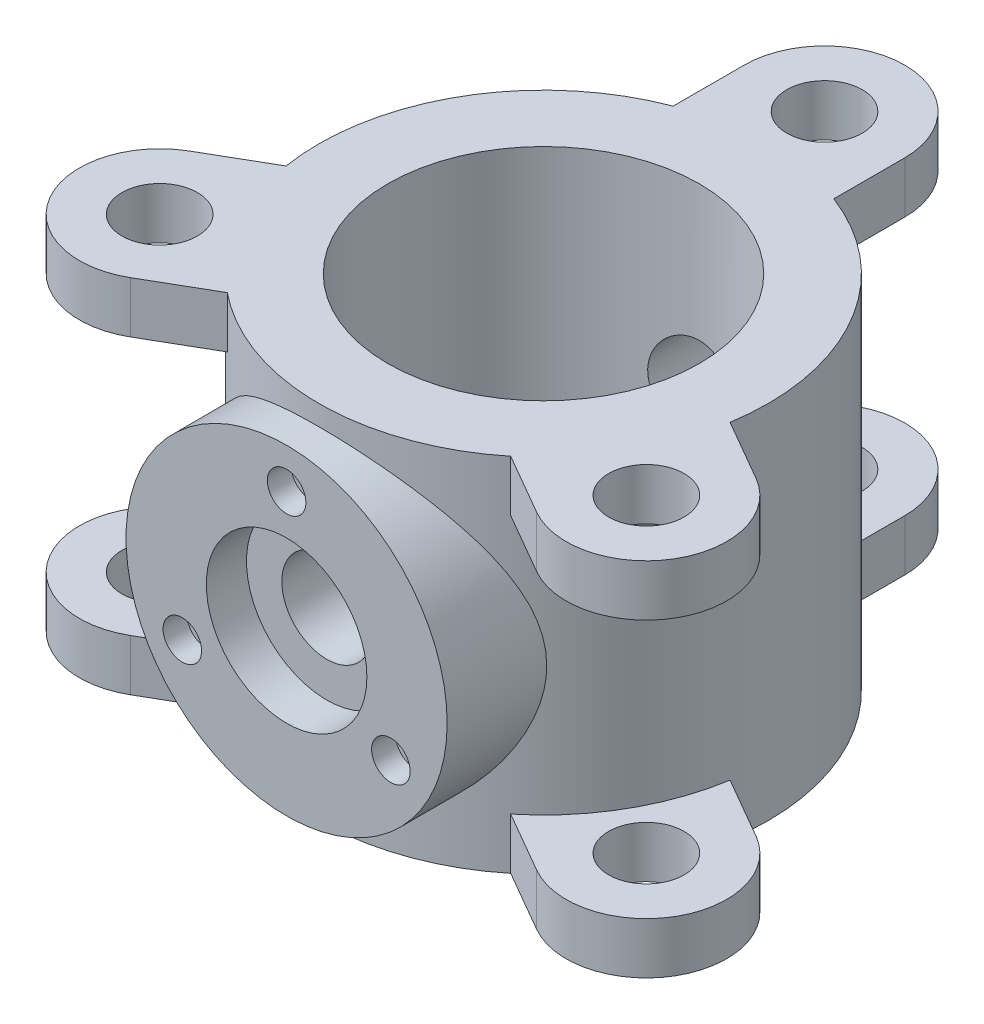
from build123d import *

# Parameters (mm, degrees)
SKETCH1_R                            = 246.38
SKETCH1_R_2                          = 59.69
BOSS_EXTRUDE1_DEPTH                  = 81.28
SKETCH2_R                            = 355.6
SKETCH2_R_2                          = 246.38
BOSS_EXTRUDE2_DEPTH                  = 204.47
BOSS_EXTRUDE3_START                  = 381
SKETCH3_R                            = 254
BOSS_EXTRUDE3_DEPTH                  = 25.4
BOSS_EXTRUDE3_DIRECTION_2_REACH      = 1339.721
BOSS_EXTRUDE3_DIRECTION_2_END_RADIUS = 355.6
SKETCH4_R                            = 30.48
CUT_EXTRUDE1_DEPTH                   = 38.1
SKETCH4_4_R                          = 127
CUT_EXTRUDE2_DEPTH                   = 63.5
SKETCH5_R                            = 71.12
CUT_EXTRUDE3_DEPTH                   = 762


with BuildPart() as part:
    # Sketch1 → Boss-Extrude1 (new body)
    with BuildSketch(Plane(origin=(0, 0, 0), x_dir=(1, 0, 0), z_dir=(0, 1, 0))):
        with BuildLine():
            Line((-127, 444.5), (-127, 332.148099498))
            ThreePointArc((-127, 332.148099498), (-307.958633586, 177.8), (-351.148691984, -56.088823468))
            Line((-351.148691984, -56.088823468), (-448.448291982, -112.264773719))
            ThreePointArc((-448.448291982, -112.264773719), (-494.933518263, -285.75), (-321.448291982, -332.235226281))
            Line((-321.448291982, -332.235226281), (-224.148691984, -276.05927603))
            ThreePointArc((-224.148691984, -276.05927603), (0, -355.6), (224.148691984, -276.05927603))
            Line((224.148691984, -276.05927603), (321.448291982, -332.235226281))
            ThreePointArc((321.448291982, -332.235226281), (494.933518263, -285.75), (448.448291982, -112.264773719))
            Line((448.448291982, -112.264773719), (351.148691984, -56.088823468))
            ThreePointArc((351.148691984, -56.088823468), (307.958633586, 177.8), (127, 332.148099498))
            Line((127, 332.148099498), (127, 444.5))
            ThreePointArc((127, 444.5), (0, 571.5), (-127, 444.5))
        make_face()
        Circle(SKETCH1_R, mode=Mode.SUBTRACT)
        with Locations((0, 444.5)):
            Circle(SKETCH1_R_2, mode=Mode.SUBTRACT)
        with Locations((384.948291982, -222.25)):
            Circle(SKETCH1_R_2, mode=Mode.SUBTRACT)
        with Locations((-384.948291982, -222.25)):
            Circle(SKETCH1_R_2, mode=Mode.SUBTRACT)
    extrude(amount=BOSS_EXTRUDE1_DEPTH)

    # Sketch2 → Boss-Extrude2 (add)
    with BuildSketch(Plane(origin=(0, 81.28, 0), x_dir=(1, 0, 0), z_dir=(0, 1, 0))):
        Circle(SKETCH2_R)
        Circle(SKETCH2_R_2, mode=Mode.SUBTRACT)
    extrude(amount=BOSS_EXTRUDE2_DEPTH)

    # Mirror2: part across plane


with BuildPart() as part_1:
    add(part.part)
    add(part.part.mirror(Plane.ZX.offset(285.75)))

    # Sketch3 → Boss-Extrude3 (add)
    with BuildSketch(Plane.XY.offset(BOSS_EXTRUDE3_START)):
        with Locations((0, 285.75)):
            Circle(SKETCH3_R)
    extrude(amount=BOSS_EXTRUDE3_DEPTH)

    # Boss-Extrude3 direction 2: up to this cylinder (the profile starts outside it)
    boss_extrude3_direction_2_end = Plane(origin=(0, 285.75, 0), z_dir=(0, -1, 0)) * Cylinder(BOSS_EXTRUDE3_DIRECTION_2_END_RADIUS, 3391.642, mode=Mode.PRIVATE)
    # Sketch3 → Boss-Extrude3 direction 2 (add, up to the surface)
    with BuildSketch(Plane.XY.offset(BOSS_EXTRUDE3_START), mode=Mode.PRIVATE) as boss_extrude3_direction_2_sk1:
        with Locations((0, 285.75)):
            Circle(SKETCH3_R)
    boss_extrude3_direction_2_tool1 = extrude(boss_extrude3_direction_2_sk1.sketch, amount=-BOSS_EXTRUDE3_DIRECTION_2_REACH, mode=Mode.PRIVATE) - boss_extrude3_direction_2_end
    add(boss_extrude3_direction_2_tool1.solids().sort_by_distance((0, 285.75, 381))[0])

    # Sketch4 → Cut-Extrude1 (cut)
    with BuildSketch(Plane.XY.offset(406.4)):
        with Locations((0, 476.25)):
            Circle(SKETCH4_R)
        with Locations((164.977839421, 190.5)):
            Circle(SKETCH4_R)
        with Locations((-164.977839421, 190.5)):
            Circle(SKETCH4_R)
    extrude(amount=-CUT_EXTRUDE1_DEPTH, mode=Mode.SUBTRACT)

    # Sketch4<4> → Cut-Extrude2 (cut)
    with BuildSketch(Plane.XY.offset(406.4)):
        with Locations((0, 285.75)):
            Circle(SKETCH4_4_R)
    extrude(amount=-CUT_EXTRUDE2_DEPTH, mode=Mode.SUBTRACT)

    # Sketch5 → Cut-Extrude3 (cut)
    with BuildSketch(Plane.XY.offset(342.9)):
        with Locations((0, 285.75)):
            Circle(SKETCH5_R)
    extrude(amount=-CUT_EXTRUDE3_DEPTH, mode=Mode.SUBTRACT)


solid = part_1.part
